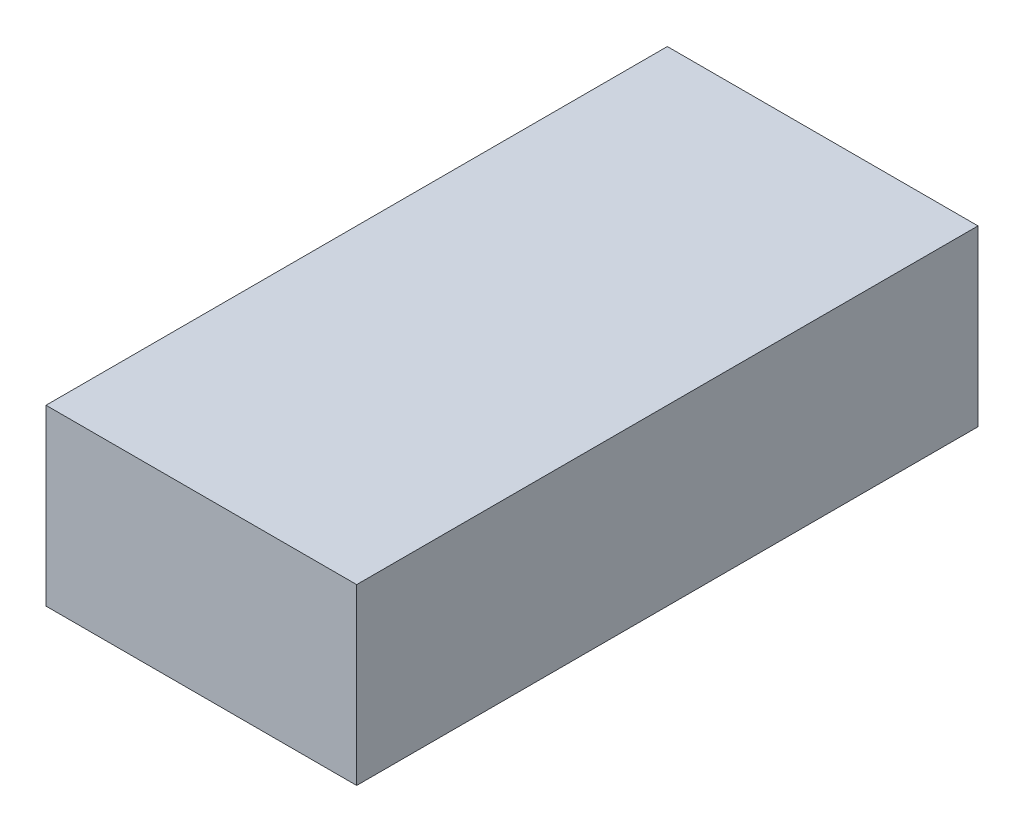
from build123d import *

# Parameters (mm, degrees)
SKETCH1_W           = 50
SKETCH1_H           = 28
BOSS_EXTRUDE1_DEPTH = 100


with BuildPart() as part:
    # Sketch1 → Boss-Extrude1 (new body)
    with BuildSketch(Plane.XY):
        Rectangle(SKETCH1_W, SKETCH1_H)
    extrude(amount=-BOSS_EXTRUDE1_DEPTH)


solid = part.part
